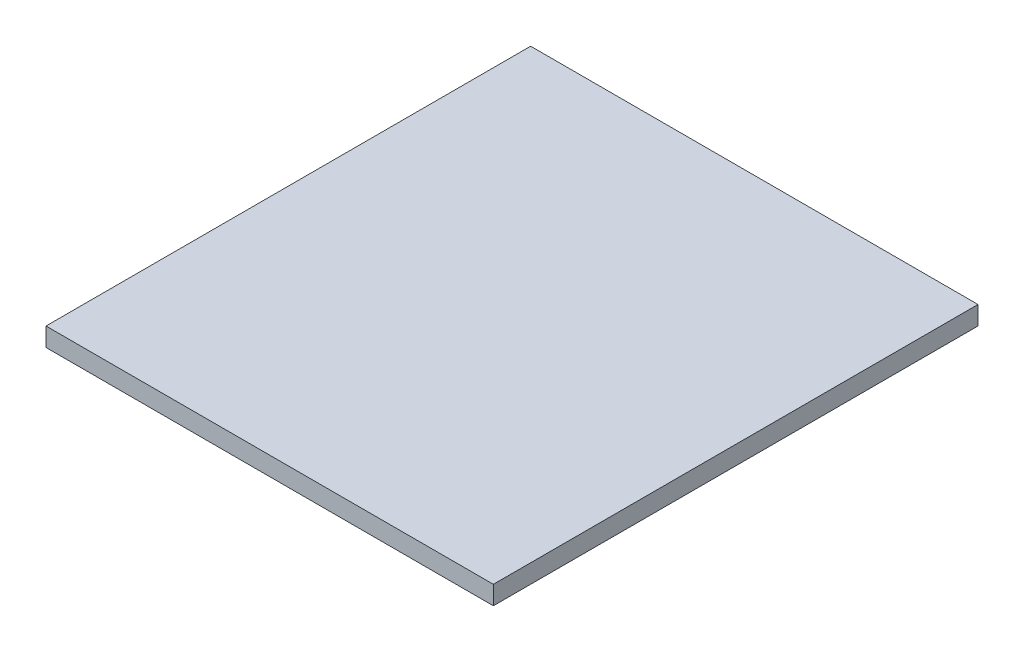
from build123d import *

# Parameters (mm, degrees)
SKETCH1_W           = 304.8
SKETCH1_H           = 330.2
BOSS_EXTRUDE1_DEPTH = 12.7


with BuildPart() as part:
    # Sketch1 → Boss-Extrude1 (new body)
    with BuildSketch(Plane(origin=(0, 0, 0), x_dir=(1, 0, 0), z_dir=(0, 1, 0))):
        with Locations((152.4, 165.1)):
            Rectangle(SKETCH1_W, SKETCH1_H)
    extrude(amount=BOSS_EXTRUDE1_DEPTH)


solid = part.part
